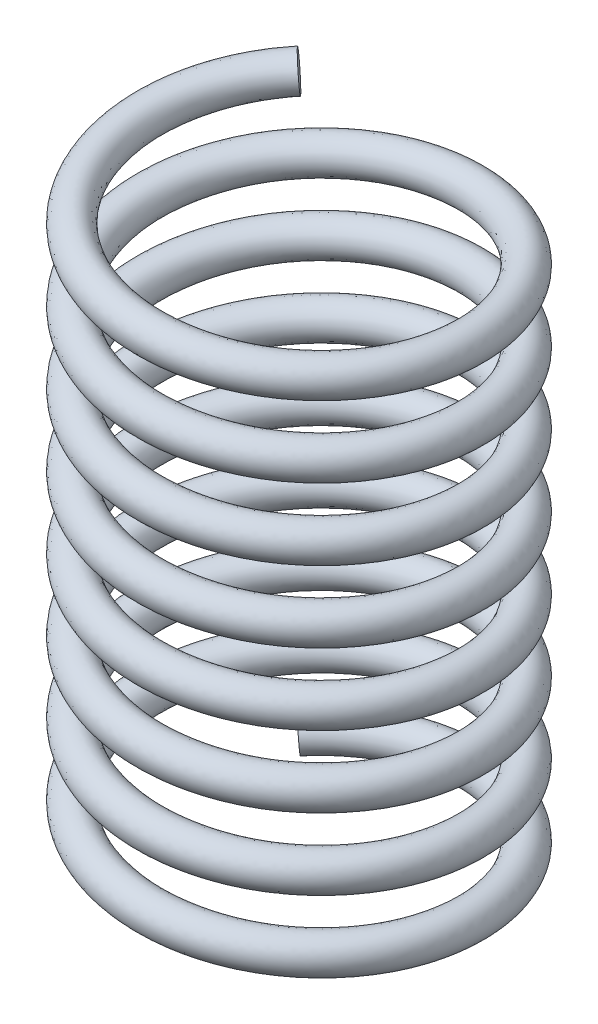
from build123d import *

# Parameters (mm, degrees)
SWEEP1_PITCH       = 2
SWEEP1_HEIGHT      = 16
SWEEP1_RADIUS      = 4.5
SWEEP1_START_ANGLE = -135
SKETCH2_R          = 0.5


with BuildPart() as part:
    # Sweep1: sweep along a helix
    with BuildLine() as sweep1_path:
        add(Helix(SWEEP1_PITCH, SWEEP1_HEIGHT, SWEEP1_RADIUS, center=(0, 0, 0), direction=(0, 1, 0), lefthand=True, mode=Mode.PRIVATE).rotate(Axis((0, 0, 0), (0, 1, 0)), SWEEP1_START_ANGLE))
    # Sketch2 → Sweep1 (sweep)
    with BuildSketch(Plane(origin=(-3.181980515, 16, -3.181980515), x_dir=(-0.6992118249981628, -0.09439804089448552, -0.7086549468239263), z_dir=(0.7053443822995938, 0.07055922843266667, -0.705344382299449))):
        Circle(SKETCH2_R)
    sweep(path=sweep1_path.line, is_frenet=True)


solid = part.part
